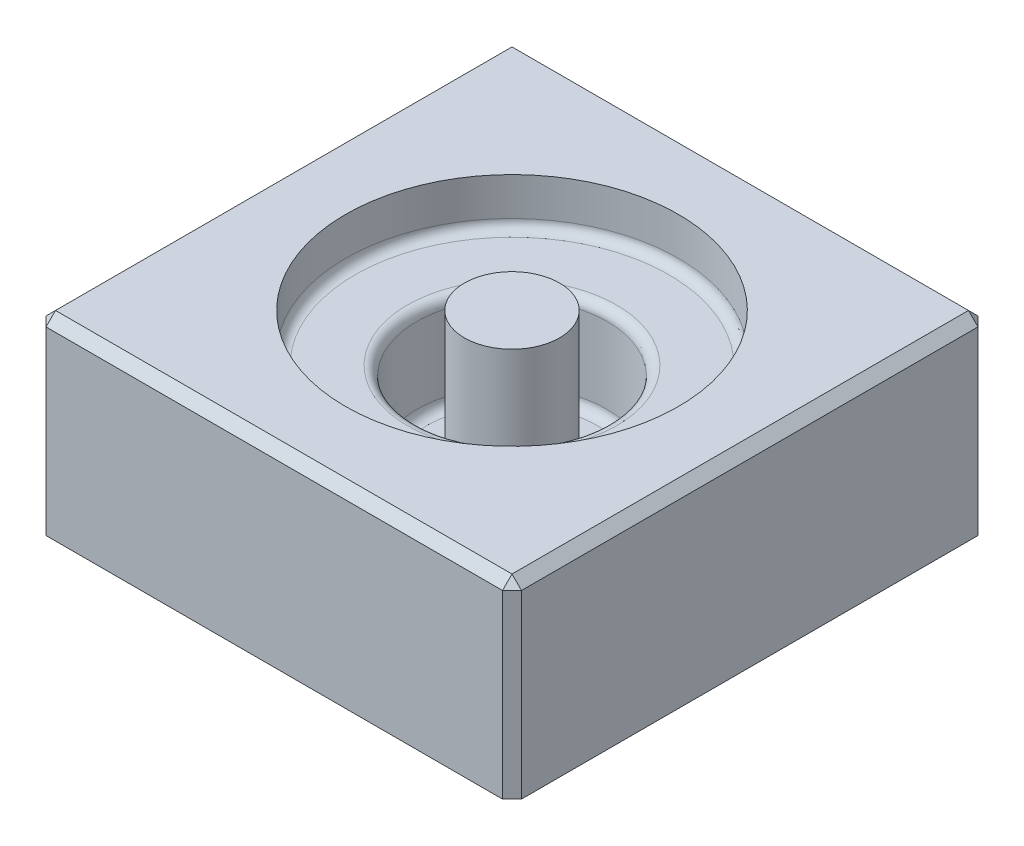
from build123d import *

# Parameters (mm, degrees)
SKETCH1_W           = 63.5
SKETCH1_H           = 63.5
BOSS_EXTRUDE1_DEPTH = 25.4
SKETCH2_R           = 22.225
CUT_EXTRUDE1_DEPTH  = 6.35
SKETCH3_R           = 12.7
CUT_EXTRUDE2_DEPTH  = 12.7
SKETCH4_R           = 6.35
BOSS_EXTRUDE2_DEPTH = 19.05
FILLET1_R           = 1.27
CHAMFER1_SIZE       = 1.27


with BuildPart() as part:
    # Sketch1 → Boss-Extrude1 (new body)
    with BuildSketch(Plane(origin=(0, 0, 0), x_dir=(1, 0, 0), z_dir=(0, 1, 0))):
        Rectangle(SKETCH1_W, SKETCH1_H)
    extrude(amount=BOSS_EXTRUDE1_DEPTH)

    # Sketch2 → Cut-Extrude1 (cut)
    with BuildSketch(Plane(origin=(0, 25.4, 0), x_dir=(1, 0, 0), z_dir=(0, 1, 0))):
        with Locations(Location((0, 0, 0), (0, 0, 270))):
            Circle(SKETCH2_R)
    extrude(amount=-CUT_EXTRUDE1_DEPTH, mode=Mode.SUBTRACT)

    # Sketch3 → Cut-Extrude2 (cut)
    with BuildSketch(Plane(origin=(0, 19.05, 0), x_dir=(1, 0, 0), z_dir=(0, 1, 0))):
        with Locations(Location((0, 0, 0), (0, 0, 270))):
            Circle(SKETCH3_R)
    extrude(amount=-CUT_EXTRUDE2_DEPTH, mode=Mode.SUBTRACT)

    # Sketch4 → Boss-Extrude2 (add)
    with BuildSketch(Plane(origin=(0, 6.35, 0), x_dir=(1, 0, 0), z_dir=(0, 1, 0))):
        with Locations(Location((0, 0, 0), (0, 0, 270))):
            Circle(SKETCH4_R)
    extrude(amount=BOSS_EXTRUDE2_DEPTH)

    # Fillet1
    fillet1_edges = [part.edges().sort_by_distance(p)[0] for p in [
        (0, 19.05, -22.225),
        (0, 6.35, -12.7),
        (0, 19.05, -12.7),
        (0, 6.35, -6.35),
    ]]
    fillet(fillet1_edges, radius=FILLET1_R)

    # Chamfer1
    chamfer1_edges = [part.edges().sort_by_distance(p)[0] for p in [
        (-31.75, 25.4, 0),
        (0, 25.4, 31.75),
        (31.75, 25.4, 0),
        (0, 25.4, -31.75),
        (31.75, 12.7, 31.75),
        (-31.75, 12.7, 31.75),
        (-31.75, 12.7, -31.75),
        (31.75, 12.7, -31.75),
    ]]
    chamfer(chamfer1_edges, length=CHAMFER1_SIZE)


solid = part.part
